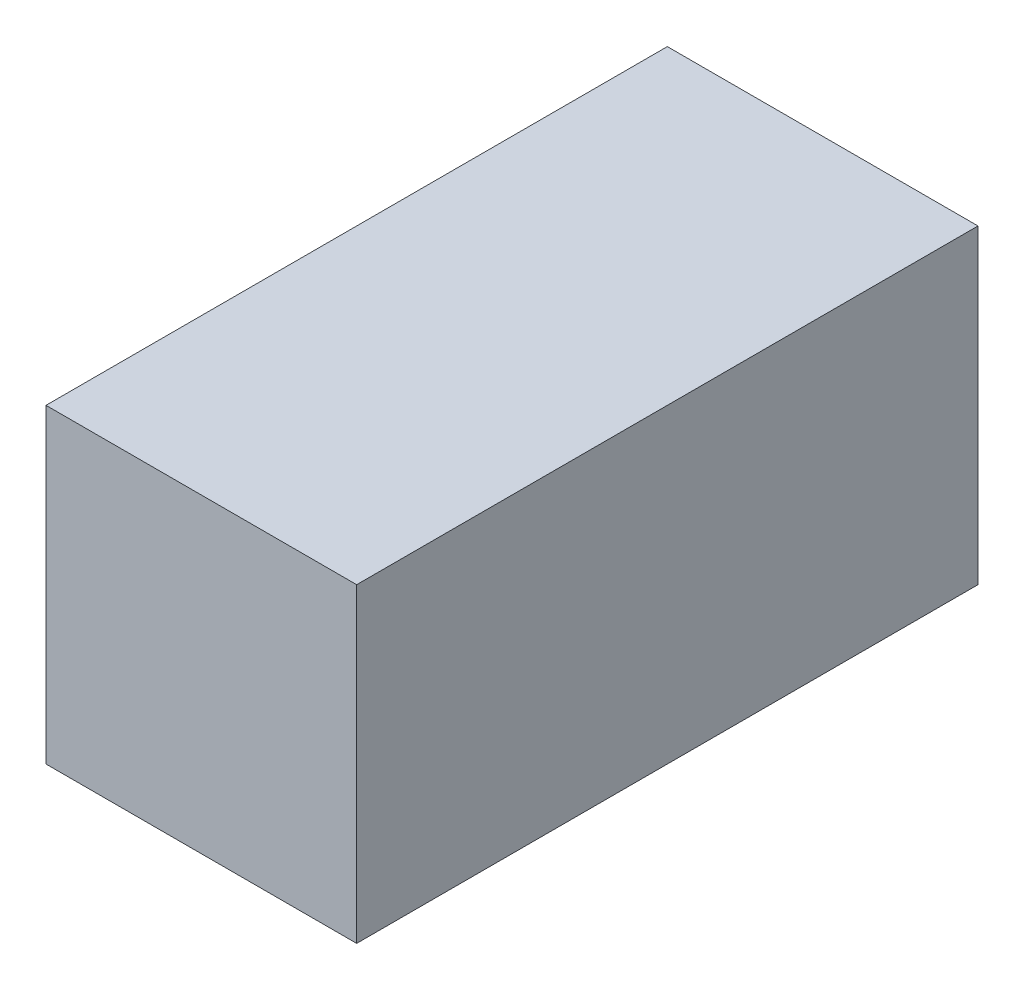
from build123d import *

# Parameters (mm, degrees)
SKETCH_1_W      = 10
SKETCH_1_H      = 10
EXTRUDE_1_DEPTH = 20


with BuildPart() as part:
    # 草图1 → 凸台-拉伸1 (new body)
    with BuildSketch(Plane.XY):
        with Locations((5, 5)):
            Rectangle(SKETCH_1_W, SKETCH_1_H)
    extrude(amount=EXTRUDE_1_DEPTH)


solid = part.part
